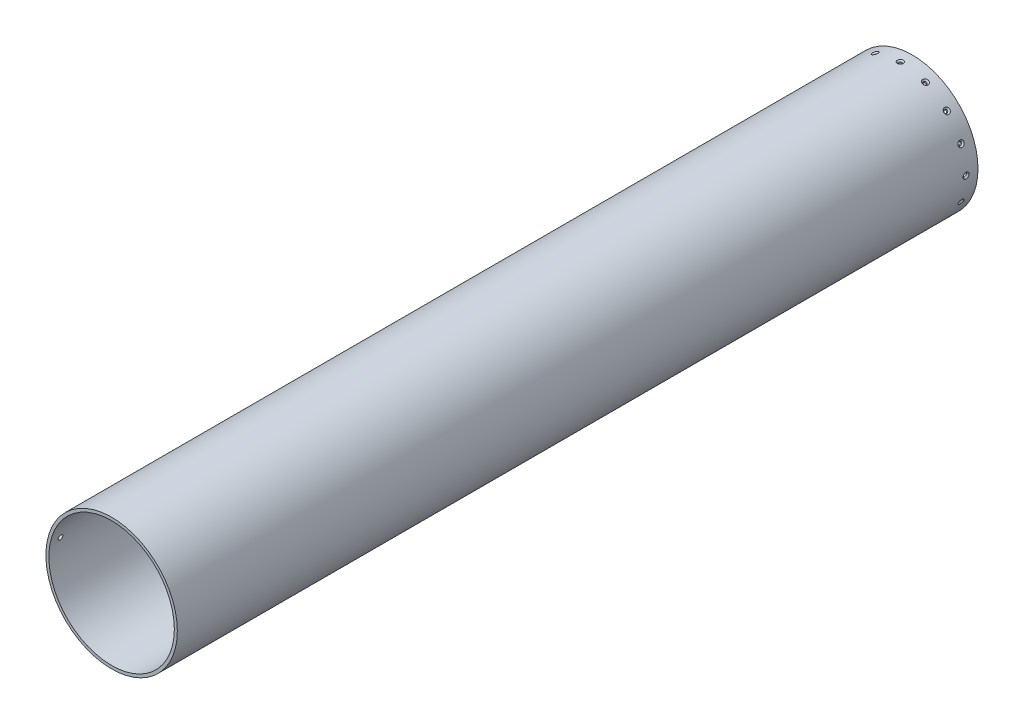
from build123d import *

# Parameters (mm, degrees)
SKETCH1_R                                       = 69.85
SKETCH1_R_2                                     = 66.675
EXTRUDE1_DEPTH                                  = 850.9
CSK_FOR_M3_FLAT_HEAD_MACHINE_SCREW1_D           = 3.4
CSK_FOR_M3_FLAT_HEAD_MACHINE_SCREW1_CSINK_D     = 6.3
CSK_FOR_M3_FLAT_HEAD_MACHINE_SCREW1_CSINK_ANGLE = 90
CIRPATTERN1_COUNT                               = 16
F_7_0_201_DIAMETER_HOLE1_D                      = 5.1054
F_7_0_201_DIAMETER_HOLE1_DEPTH                  = 10.16
F_7_0_201_DIAMETER_HOLE1_TIP                    = 1.533816902


with BuildPart() as part:
    # Sketch1 → Extrude1 (new body)
    with BuildSketch(Plane.XY):
        Circle(SKETCH1_R)
        Circle(SKETCH1_R_2, mode=Mode.SUBTRACT)
    extrude(amount=EXTRUDE1_DEPTH)

    # CSK for M3 Flat Head Machine Screw1 (through all)
    with Locations(Plane(origin=(0, -69.85, 12.7), x_dir=(1, 0, 0), z_dir=(0, -1, 0))):
        with Locations((0, 0)):
            csk_for_m3_flat_head_machine_screw1 = CounterSinkHole(CSK_FOR_M3_FLAT_HEAD_MACHINE_SCREW1_D / 2, CSK_FOR_M3_FLAT_HEAD_MACHINE_SCREW1_CSINK_D / 2, counter_sink_angle=CSK_FOR_M3_FLAT_HEAD_MACHINE_SCREW1_CSINK_ANGLE)

    # CirPattern1: CSK for M3 Flat Head Machine Screw1 ×16 about axis
    cirpattern1_axis = Axis((0, 0, 850.9), (0, 0, -1))
    for i in range(1, CIRPATTERN1_COUNT):
        add(csk_for_m3_flat_head_machine_screw1.rotate(cirpattern1_axis, i * 360 / CIRPATTERN1_COUNT), mode=Mode.SUBTRACT)

    # #7 (0.201) Diameter Hole1
    with Locations(Plane(origin=(-68.507851836, 13.627058993, 425.45), x_dir=(0.19509032201613552, 0.9807852804032291, 0), z_dir=(-0.9807852804032291, 0.19509032201613552, 0))):
        with Locations((0, -414.3248)):
            Hole(F_7_0_201_DIAMETER_HOLE1_D / 2, depth=F_7_0_201_DIAMETER_HOLE1_DEPTH)
            with Locations((0, 0, -(F_7_0_201_DIAMETER_HOLE1_DEPTH + F_7_0_201_DIAMETER_HOLE1_TIP / 2))):  # 118° drill point
                Cone(0, F_7_0_201_DIAMETER_HOLE1_D / 2, F_7_0_201_DIAMETER_HOLE1_TIP, mode=Mode.SUBTRACT)


solid = part.part
